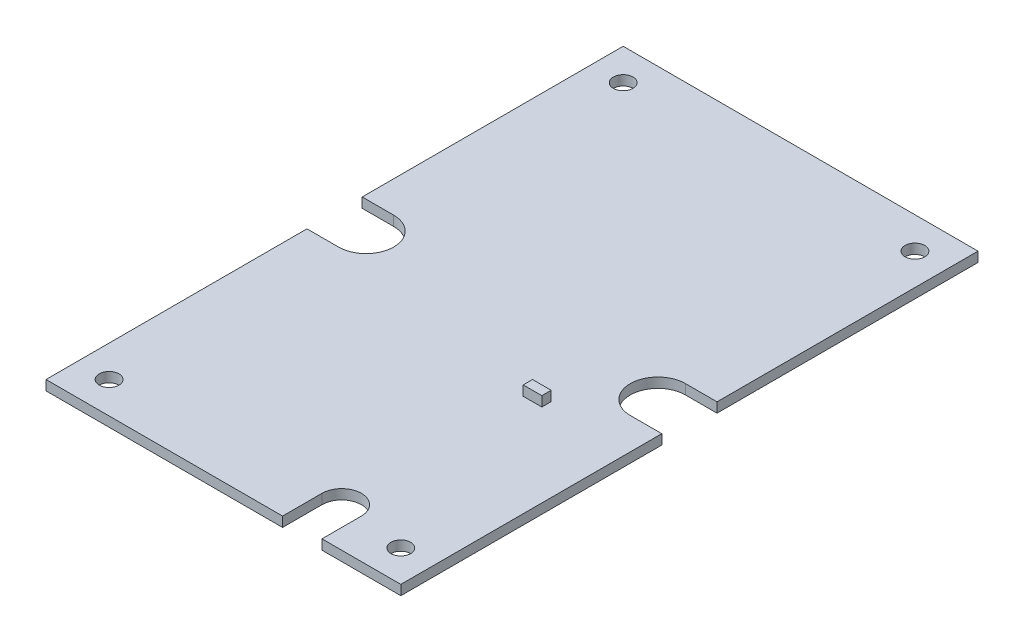
from build123d import *

# Parameters (mm, degrees)
SKETCH1_W           = 57.15
SKETCH1_H           = 92.964
BOSS_EXTRUDE1_DEPTH = 1.5875
SKETCH2_R           = 1.5875
CUT_EXTRUDE1_DEPTH  = 110.137289467
CUT_EXTRUDE2_DEPTH  = 110.137289467
CUT_EXTRUDE3_REACH  = 111.137
SKETCH5_R           = 4.7244
BOSS_EXTRUDE2_DEPTH = 6.35
SKETCH5_3_W         = 4
SKETCH5_3_H         = 4
SKETCH5_3_H_2       = 3
BOSS_EXTRUDE3_DEPTH = 1.5875
SKETCH7_W           = 3
SKETCH7_H           = 1.5
BOSS_EXTRUDE4_DEPTH = 1.5875


with BuildPart() as part:
    # Sketch1 → Boss-Extrude1 (new body)
    with BuildSketch(Plane(origin=(0, 0, 0), x_dir=(1, 0, 0), z_dir=(0, 1, 0))):
        with Locations((28.575, 46.482)):
            Rectangle(SKETCH1_W, SKETCH1_H)
    extrude(amount=BOSS_EXTRUDE1_DEPTH)

    # Sketch2 → Cut-Extrude1 (cut, through all)
    with BuildSketch(Plane(origin=(0, 1.5875, 0), x_dir=(1, 0, 0), z_dir=(0, 1, 0))):
        with Locations((5.08, 87.884)):
            Circle(SKETCH2_R)
        with Locations((52.07, 87.884)):
            Circle(SKETCH2_R)
        with Locations((5.08, 5.08)):
            Circle(SKETCH2_R)
        with Locations((52.07, 5.08)):
            Circle(SKETCH2_R)
    extrude(amount=-CUT_EXTRUDE1_DEPTH, mode=Mode.SUBTRACT)

    # Sketch3 → Cut-Extrude2 (cut, through all)
    with BuildSketch(Plane(origin=(0, 1.5875, 0), x_dir=(1, 0, 0), z_dir=(0, 1, 0))):
        with BuildLine():
            Line((57.15, 50.927), (52.07, 50.927))
            ThreePointArc((52.07, 50.927), (47.625, 46.482), (52.07, 42.037))
            Line((52.07, 42.037), (57.15, 42.037))
            Line((57.15, 42.037), (57.15, 50.927))
        make_face()
        with BuildLine():
            Line((5.08, 50.927), (0, 50.927))
            Line((0, 50.927), (0, 42.037))
            Line((0, 42.037), (5.08, 42.037))
            ThreePointArc((5.08, 42.037), (9.525, 46.482), (5.08, 50.927))
        make_face()
    extrude(amount=-CUT_EXTRUDE2_DEPTH, mode=Mode.SUBTRACT)

    # Sketch4 → Cut-Extrude3 (cut, up to next)
    with BuildSketch(Plane(origin=(0, 1.5875, 0), x_dir=(1, 0, 0), z_dir=(0, 1, 0)), mode=Mode.PRIVATE) as cut_extrude3_sk1:
        with BuildLine():
            ThreePointArc((44.45, 6.35), (41.275, 9.525), (38.1, 6.35))
            Line((38.1, 6.35), (38.1, 0))
            Line((38.1, 0), (44.45, 0))
            Line((44.45, 0), (44.45, 6.35))
        make_face()
    cut_extrude3_tool1 = extrude(cut_extrude3_sk1.sketch, amount=-CUT_EXTRUDE3_REACH, mode=Mode.PRIVATE) & part.part
    add(cut_extrude3_tool1.solids().sort_by_distance((41.275, 1.5875, -4.450212))[0], mode=Mode.SUBTRACT)

    # Sketch5 → Boss-Extrude2 (add)
    with BuildSketch(Plane.XZ):
        with Locations((5.08, -70.739)):
            Circle(SKETCH5_R)
    extrude(amount=BOSS_EXTRUDE2_DEPTH)

    # Sketch5<3> → Boss-Extrude3 (add)
    with BuildSketch(Plane.XZ):
        with Locations((5.064710223, -57.987286883)):
            Rectangle(SKETCH5_3_W, SKETCH5_3_H)
        with Locations((5.164801178, -80.177059989)):
            Rectangle(SKETCH5_3_W, SKETCH5_3_H_2)
    extrude(amount=BOSS_EXTRUDE3_DEPTH)

    # Sketch7 → Boss-Extrude4 (add)
    with BuildSketch(Plane(origin=(0, 1.5875, 0), x_dir=(1, 0, 0), z_dir=(0, 1, 0))):
        with Locations((42.270458801, 36.842)):
            Rectangle(SKETCH7_W, SKETCH7_H)
    extrude(amount=BOSS_EXTRUDE4_DEPTH)


solid = part.part
